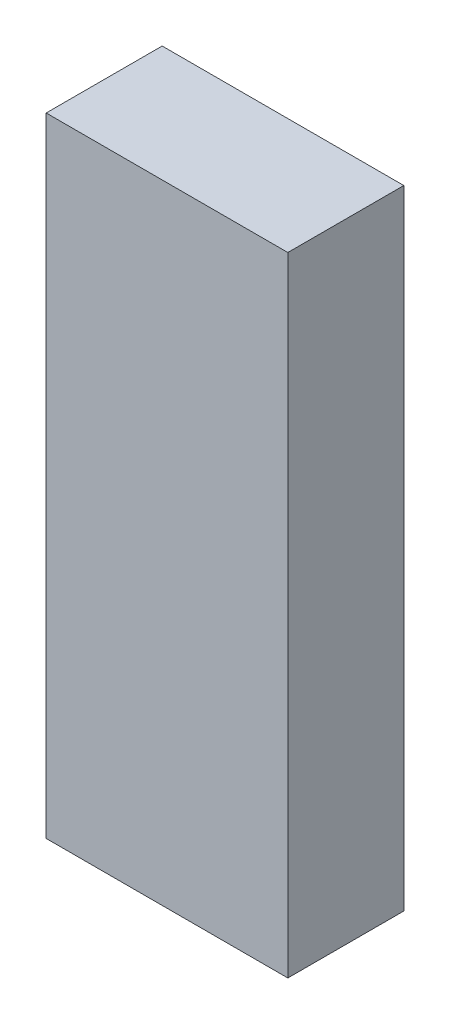
from build123d import *

# Parameters (mm, degrees)
ESQUISSE1_W        = 25
ESQUISSE1_H        = 65
BOSS_EXTRU_1_DEPTH = 12


with BuildPart() as part:
    # Esquisse1 → Boss.-Extru.1 (new body)
    with BuildSketch(Plane.XY):
        with Locations((-12.5, 32.5)):
            Rectangle(ESQUISSE1_W, ESQUISSE1_H)
    extrude(amount=BOSS_EXTRU_1_DEPTH)


solid = part.part
